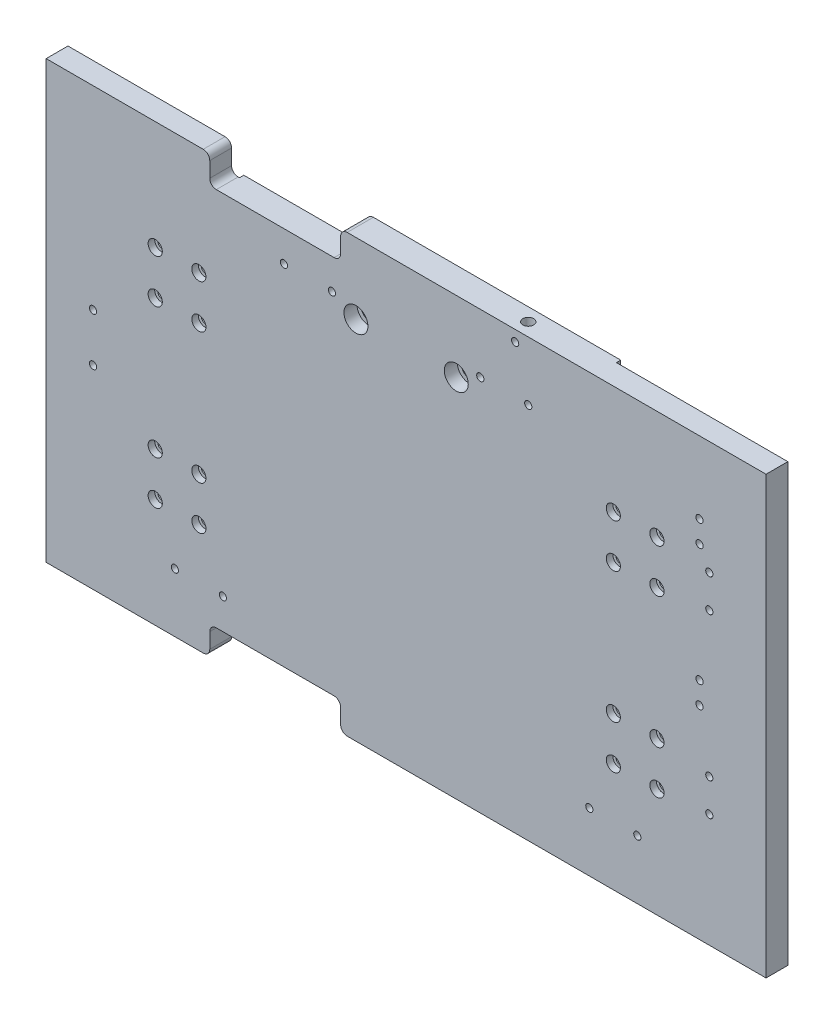
from build123d import *

# Parameters (mm, degrees)
SKETCH_1_W                   = 330
SKETCH_1_H                   = 200
EXTRUDE_1_DEPTH              = 12
SKETCH_2_W                   = 78.6
SKETCH_2_H                   = 2
CUT_EXTRUDE_1_DEPTH          = 387.062171159
SKETCH_4_R                   = 2.5
CUT_EXTRUDE_3_DEPTH          = 12
HOLE_WIZARD_M4_1_D           = 3.3
HOLE_WIZARD_M4_1_DEPTH       = 10.1
HOLE_WIZARD_M4_1_TIP         = 0.991420021
HOLE_WIZARD_M6_1_D           = 7
HOLE_WIZARD_M6_1_CBORE_D     = 11
HOLE_WIZARD_M6_1_CBORE_DEPTH = 6
HOLE_WIZARD_M3_1_D           = 3.6
HOLE_WIZARD_M3_1_CBORE_D     = 6.5
HOLE_WIZARD_M3_1_CBORE_DEPTH = 3
SKETCH_11_W                  = 60
SKETCH_11_H                  = 13
CUT_EXTRUDE_4_DEPTH          = 387.062171159
FILLET_1_R                   = 3
HOLE_WIZARD_M4_2_D           = 3.3
HOLE_WIZARD_M4_2_DEPTH       = 10.1
HOLE_WIZARD_M4_2_TIP         = 0.991420021
HOLE_WIZARD_M4_4_D           = 3.3
HOLE_WIZARD_M4_4_DEPTH       = 10.1
HOLE_WIZARD_M4_4_TIP         = 0.991420021
HOLE_WIZARD_M4_5_D           = 3.3
HOLE_WIZARD_M4_5_DEPTH       = 10.1
HOLE_WIZARD_M4_5_TIP         = 0.991420021


with BuildPart() as part:
    # 草图1 → 凸台-拉伸1 (new body)
    with BuildSketch(Plane.XY):
        with Locations((165, 100)):
            Rectangle(SKETCH_1_W, SKETCH_1_H)
    extrude(amount=EXTRUDE_1_DEPTH)

    # 草图2 → 切除-拉伸1 (cut, through all)
    with BuildSketch(Plane.XZ):
        with Locations((39.3, 1)):
            Rectangle(SKETCH_2_W, SKETCH_2_H)
        with Locations((290.7, 1)):
            Rectangle(SKETCH_2_W, SKETCH_2_H)
    extrude(amount=-CUT_EXTRUDE_1_DEPTH, mode=Mode.SUBTRACT)

    # 草图4 → 切除-拉伸3 (cut)
    with BuildSketch(Plane(origin=(0, 200, 0), x_dir=(1, 0, 0), z_dir=(0, 1, 0))):
        with Locations(Location((215, -6, 0), (0, 0, 270))):
            Circle(SKETCH_4_R)
    extrude(amount=-CUT_EXTRUDE_3_DEPTH, mode=Mode.SUBTRACT)

    # M4 螺纹孔1
    with Locations(Plane.XY.offset(12)):
        with Locations((109, 173), (131, 173), (199, 173), (221, 173), (21.5, 111), (21.5, 89), (59, 27), (81, 27), (249, 27), (271, 27), (304, 52), (304, 67), (304, 133), (304, 148)):
            Hole(HOLE_WIZARD_M4_1_D / 2, depth=HOLE_WIZARD_M4_1_DEPTH)
            with Locations((0, 0, -(HOLE_WIZARD_M4_1_DEPTH + HOLE_WIZARD_M4_1_TIP / 2))):  # 118° drill point
                Cone(0, HOLE_WIZARD_M4_1_D / 2, HOLE_WIZARD_M4_1_TIP, mode=Mode.SUBTRACT)

    # M6 六角凹头螺钉的柱形沉头孔1 (through all)
    with Locations(Plane.XY.offset(12)):
        with Locations((188, 167.5), (142, 167.5)):
            CounterBoreHole(HOLE_WIZARD_M6_1_D / 2, HOLE_WIZARD_M6_1_CBORE_D / 2, HOLE_WIZARD_M6_1_CBORE_DEPTH)

    # M3 六角凹头螺钉的柱形沉头孔1 (through all)
    with Locations(Plane.XY.offset(12)):
        with Locations((70, 150), (50, 150), (50, 130), (70, 130), (70, 50), (50, 50), (70, 70), (50, 70), (280, 50), (260, 50), (280, 70), (260, 70), (280, 150), (260, 150), (280, 130), (260, 130)):
            CounterBoreHole(HOLE_WIZARD_M3_1_D / 2, HOLE_WIZARD_M3_1_CBORE_D / 2, HOLE_WIZARD_M3_1_CBORE_DEPTH)

    # 草图11 → 切除-拉伸4 (cut, through all)
    with BuildSketch(Plane.XY.offset(12)):
        with Locations((105, 193.5)):
            Rectangle(SKETCH_11_W, SKETCH_11_H)
        with Locations((105, 6.5)):
            Rectangle(SKETCH_11_W, SKETCH_11_H)
    extrude(amount=-CUT_EXTRUDE_4_DEPTH, mode=Mode.SUBTRACT)

    # 圆角1
    fillet_1_edges = [part.edges().sort_by_distance(p)[0] for p in [
        (75, 187, 7),
        (135, 187, 6),
        (75, 200, 7),
        (135, 200, 6),
        (75, 0, 7),
        (135, 0, 6),
        (75, 13, 7),
        (135, 13, 6),
    ]]
    fillet(fillet_1_edges, radius=FILLET_1_R)

    # M4 螺纹孔2
    with Locations(Plane.XY.offset(12)):
        with Locations((215, 195)):
            Hole(HOLE_WIZARD_M4_2_D / 2, depth=HOLE_WIZARD_M4_2_DEPTH)
            with Locations((0, 0, -(HOLE_WIZARD_M4_2_DEPTH + HOLE_WIZARD_M4_2_TIP / 2))):  # 118° drill point
                Cone(0, HOLE_WIZARD_M4_2_D / 2, HOLE_WIZARD_M4_2_TIP, mode=Mode.SUBTRACT)

    # M4 螺纹孔4
    with Locations(Plane(origin=(0, 0, 2), x_dir=(-1, 0, 0), z_dir=(0, 0, -1))):
        with Locations((-299.5, 167), (-299.5, 157), (-299.5, 103), (-299.5, 93)):
            Hole(HOLE_WIZARD_M4_4_D / 2, depth=HOLE_WIZARD_M4_4_DEPTH)
            with Locations((0, 0, -(HOLE_WIZARD_M4_4_DEPTH + HOLE_WIZARD_M4_4_TIP / 2))):  # 118° drill point
                Cone(0, HOLE_WIZARD_M4_4_D / 2, HOLE_WIZARD_M4_4_TIP, mode=Mode.SUBTRACT)

    # M4 螺纹孔5
    with Locations(Plane(origin=(0, 0, 0), x_dir=(-1, 0, 0), z_dir=(0, 0, -1))):
        with Locations((-89.5, 158), (-89.5, 168), (-89.5, 93), (-89.5, 103)):
            Hole(HOLE_WIZARD_M4_5_D / 2, depth=HOLE_WIZARD_M4_5_DEPTH)
            with Locations((0, 0, -(HOLE_WIZARD_M4_5_DEPTH + HOLE_WIZARD_M4_5_TIP / 2))):  # 118° drill point
                Cone(0, HOLE_WIZARD_M4_5_D / 2, HOLE_WIZARD_M4_5_TIP, mode=Mode.SUBTRACT)


solid = part.part
